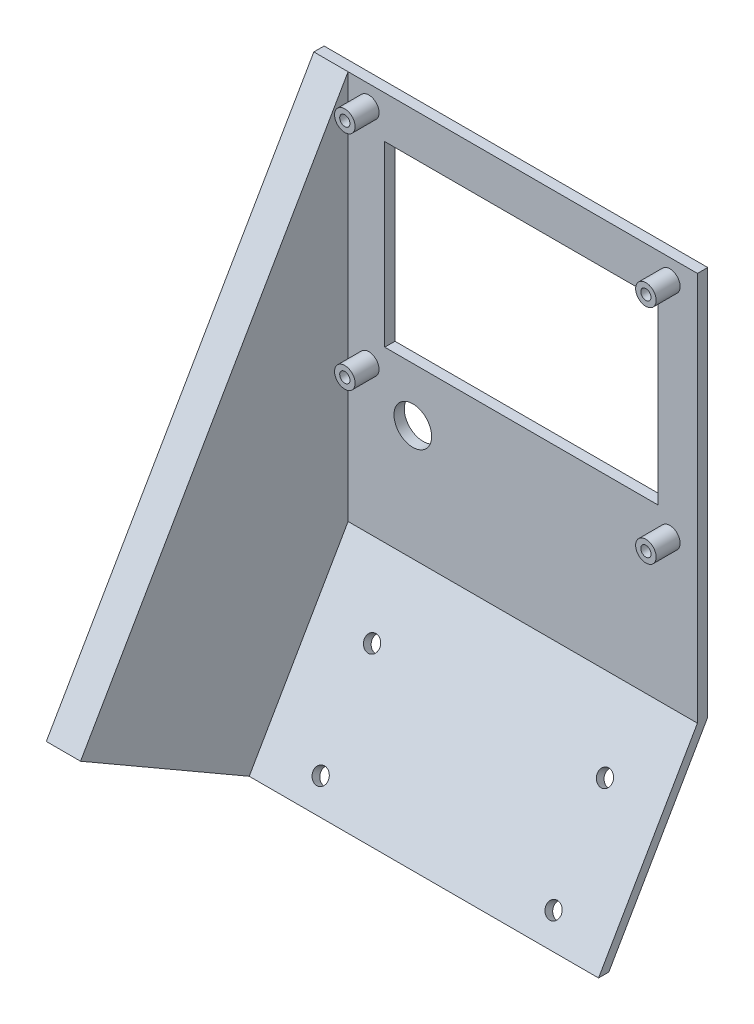
from build123d import *

# Parameters (mm, degrees)
SKETCH1_W           = 102
SKETCH1_H           = 113.73
SKETCH1_R           = 3
SKETCH1_R_2         = 5.5
SKETCH1_W_2         = 79.8
SKETCH1_H_2         = 52
BOSS_EXTRUDE1_DEPTH = 3
SKETCH1_3_R         = 3
BOSS_EXTRUDE2_DEPTH = 10
SKETCH2_R           = 1.5
CUT_EXTRUDE1_DEPTH  = 7
BOSS_EXTRUDE3_DEPTH = 102
SKETCH4_R           = 2.25
CUT_EXTRUDE2_DEPTH  = 155.667120928
BOSS_EXTRUDE4_DEPTH = 10


with BuildPart() as part:
    # Sketch1 → Boss-Extrude1 (new body)
    with BuildSketch(Plane.XY):
        with Locations((51, 56.865)):
            Rectangle(SKETCH1_W, SKETCH1_H)
        with Locations((6.05, 42.97)):
            Circle(SKETCH1_R, mode=Mode.SUBTRACT)
        with Locations((93.95, 42.97)):
            Circle(SKETCH1_R, mode=Mode.SUBTRACT)
        with Locations((18.9, 33.699)):
            Circle(SKETCH1_R_2, mode=Mode.SUBTRACT)
        with Locations((50.6, 75.42)):
            Rectangle(SKETCH1_W_2, SKETCH1_H_2, mode=Mode.SUBTRACT)
    extrude(amount=BOSS_EXTRUDE1_DEPTH)

    # Sketch1<3> → Boss-Extrude2 (add)
    with BuildSketch(Plane.XY):
        with Locations((6.05, 107.87)):
            Circle(SKETCH1_3_R)
        with Locations((93.95, 107.87)):
            Circle(SKETCH1_3_R)
        with Locations((6.05, 42.97)):
            Circle(SKETCH1_3_R)
        with Locations((93.95, 42.97)):
            Circle(SKETCH1_3_R)
    extrude(amount=BOSS_EXTRUDE2_DEPTH)

    # Sketch2 → Cut-Extrude1 (cut)
    with BuildSketch(Plane.XY.offset(10)):
        with Locations((6.05, 107.87)):
            Circle(SKETCH2_R)
        with Locations((93.95, 107.87)):
            Circle(SKETCH2_R)
        with Locations((93.95, 42.97)):
            Circle(SKETCH2_R)
        with Locations((6.05, 42.97)):
            Circle(SKETCH2_R)
    extrude(amount=-CUT_EXTRUDE1_DEPTH, mode=Mode.SUBTRACT)

    # Sketch3 → Boss-Extrude3 (add)
    with BuildSketch(Plane(origin=(102, 0, 0), x_dir=(0, 0, -1), z_dir=(1, 0, 0))):
        Polygon((-3, 0), (-31.867513459, -50), (-28.867513459, -50), (0, 0), align=None)
    extrude(amount=-BOSS_EXTRUDE3_DEPTH)

    # Sketch4 → Cut-Extrude2 (cut, through all)
    with BuildSketch(Plane(origin=(0, 1.299038106, 2.25), x_dir=(1, 0, 0), z_dir=(0, 0.4999999999999944, 0.8660254037844419))):
        with Locations(Location((17, -21.5, 0), (0, 0, 270))):
            Circle(SKETCH4_R)
        with Locations(Location((85, -21.5, 0), (0, 0, 270))):
            Circle(SKETCH4_R)
        with Locations(Location((85, -51.5, 0), (0, 0, 90))):
            Circle(SKETCH4_R)
        with Locations(Location((17, -51.5, 0), (0, 0, 90))):
            Circle(SKETCH4_R)
    extrude(amount=-CUT_EXTRUDE2_DEPTH, mode=Mode.SUBTRACT)

    # Sketch5 → Boss-Extrude4 (add)
    with BuildSketch(Plane.ZY):
        Polygon((31.867513459, -50), (81.114048046, -21.5675), (3, 113.73), (0, 113.73), (0, 0), (28.867513459, -50), align=None)
    extrude(amount=BOSS_EXTRUDE4_DEPTH)


solid = part.part
